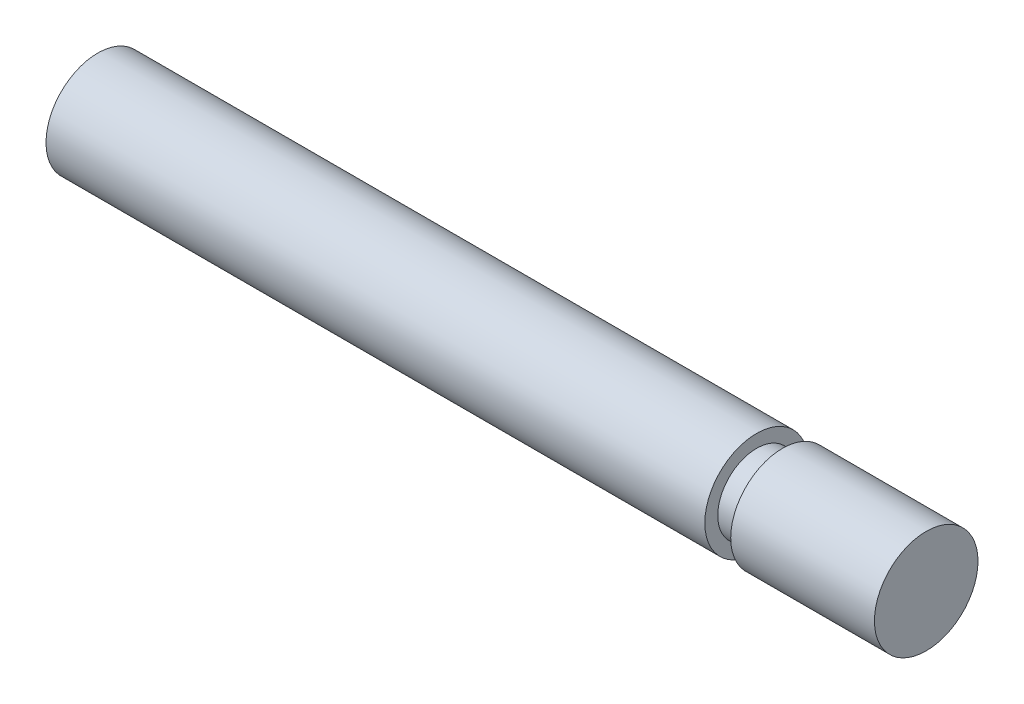
from build123d import *

# Parameters (mm, degrees)
BOSS_EXTRUDE1_START = 100
SKETCH4_R           = 50
BOSS_EXTRUDE1_DEPTH = 100


with BuildPart() as part:
    # Sketch3 → Revolve1 (revolve)
    with BuildSketch(Plane.XY, mode=Mode.PRIVATE) as revolve1_sk:
        Polygon((0, 0), (0, 50), (2.676183962, 50), (636.2, 50), (636.2, 37.5), (661.2, 37.5), (661.2, 50), (700, 50), (700, 0), align=None)
    revolve(revolve1_sk.sketch.rotate(Axis((0, 0, 0), (1, 0, 0)), 90), axis=Axis((0, 0, 0), (1, 0, 0)))

    # Sketch4 → Boss-Extrude1 (add)
    with BuildSketch(Plane(origin=(700, 0, 0), x_dir=(0, 0, -1), z_dir=(1, 0, 0)).offset(BOSS_EXTRUDE1_START)):
        with Locations(Location((0, 0, 0), (0, 0, 180))):
            Circle(SKETCH4_R)
    extrude(amount=-BOSS_EXTRUDE1_DEPTH)


solid = part.part
